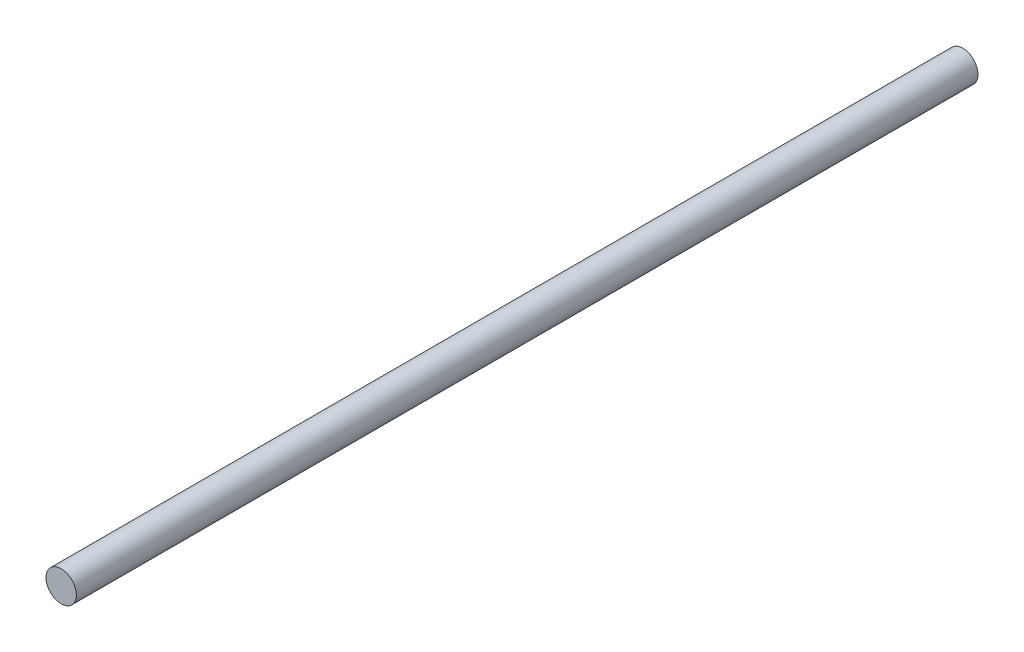
from build123d import *

# Parameters (mm, degrees)
SKETCH1_R           = 1.5
BOSS_EXTRUDE1_DEPTH = 89


with BuildPart() as part:
    # Sketch1 → Boss-Extrude1 (new body)
    with BuildSketch(Plane.XY):
        Circle(SKETCH1_R)
    extrude(amount=BOSS_EXTRUDE1_DEPTH)


solid = part.part
